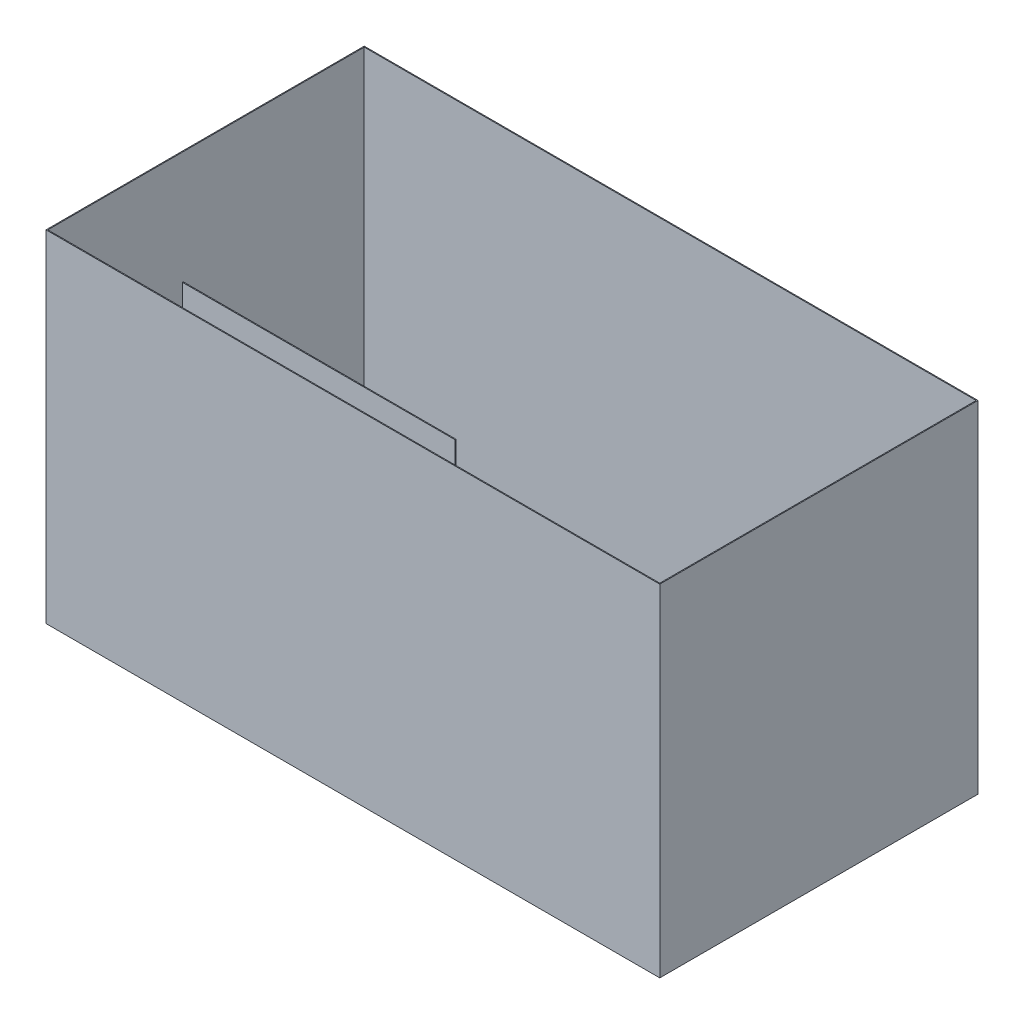
from build123d import *

# Parameters (mm, degrees)
MASTER_FOOTPRINT_W           = 1350
MASTER_FOOTPRINT_H           = 700
BATH_BASE_PLATE_DEPTH        = 750
BATH_SHELL_2MM_T             = -2
DISTRIBUTOR_PANEL_TEST_START = 100
SKETCH_1_W                   = 600
SKETCH_1_H                   = 2
DISTRIBUTOR_PANEL_TEST_DEPTH = 450


with BuildPart() as part:
    # MASTER_FOOTPRINT → BATH_BASE_PLATE (new body)
    with BuildSketch(Plane(origin=(0, 0, 0), x_dir=(1, 0, 0), z_dir=(0, 1, 0))):
        with Locations((675, 350)):
            Rectangle(MASTER_FOOTPRINT_W, MASTER_FOOTPRINT_H)
    extrude(amount=BATH_BASE_PLATE_DEPTH)

    # BATH_SHELL_2MM
    bath_shell_2mm_openings = [part.faces().sort_by_distance(p)[0] for p in [
        (675, 750, -350),
    ]]
    offset(amount=BATH_SHELL_2MM_T, openings=bath_shell_2mm_openings, kind=Kind.INTERSECTION)


with BuildPart() as body_2:
    # Эскиз1 → DISTRIBUTOR_PANEL_TEST (new body)
    with BuildSketch(Plane(origin=(0, 0, 0), x_dir=(1, 0, 0), z_dir=(0, 1, 0)).offset(DISTRIBUTOR_PANEL_TEST_START)):
        with Locations((350, 251)):
            Rectangle(SKETCH_1_W, SKETCH_1_H)
    extrude(amount=DISTRIBUTOR_PANEL_TEST_DEPTH)


solid = Compound([part.part, body_2.part])
